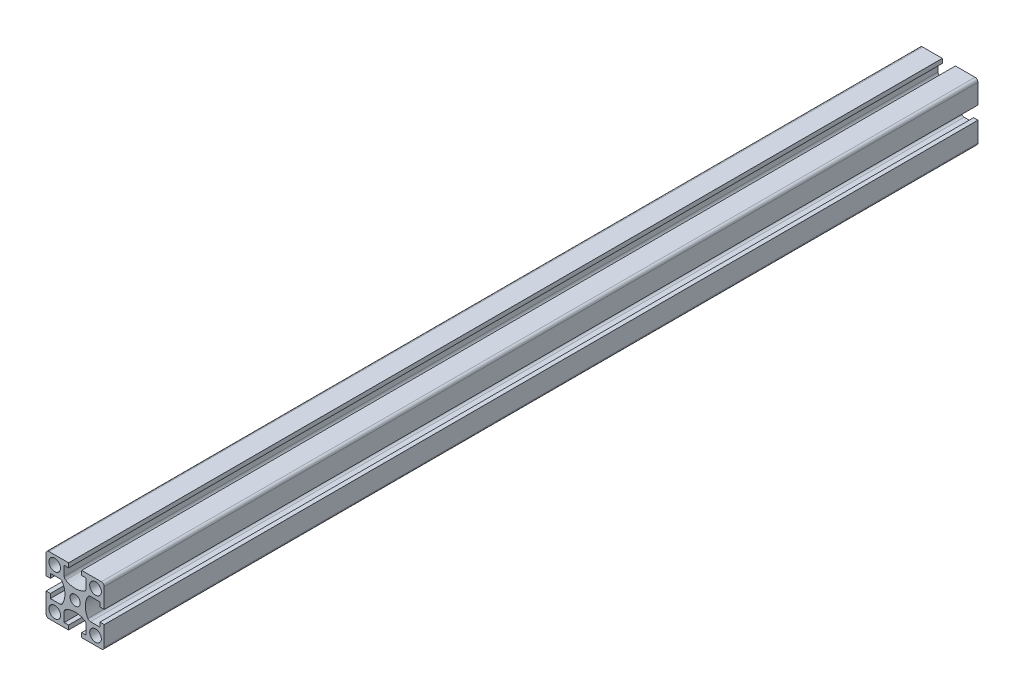
from build123d import *

# Parameters (mm, degrees)
SKETCH1_R           = 4
SKETCH1_R_2         = 3.5
BOSS_EXTRUDE1_DEPTH = 600


with BuildPart() as part:
    # Sketch1 → Boss-Extrude1 (new body)
    with BuildSketch(Plane.XY):
        with BuildLine():
            Line((-20, 18), (-20, 4.5))
            Line((-20, 4.5), (-17, 4.5))
            Line((-17, 4.5), (-17, 7.5))
            Line((-17, 7.5), (-10.473720558, 7.5))
            ThreePointArc((-10.473720558, 7.5), (-9.473720558, 7.232050808), (-8.741669751, 6.5))
            ThreePointArc((-8.741669751, 6.5), (-7, 0), (-8.741669751, -6.5))
            ThreePointArc((-8.741669751, -6.5), (-9.473720558, -7.232050808), (-10.473720558, -7.5))
            Line((-10.473720558, -7.5), (-17, -7.5))
            Line((-17, -7.5), (-17, -4.5))
            Line((-17, -4.5), (-20, -4.5))
            Line((-20, -4.5), (-20, -18))
            ThreePointArc((-20, -18), (-19.414213562, -19.414213562), (-18, -20))
            Line((-18, -20), (-4.5, -20))
            Line((-4.5, -20), (-4.5, -17))
            Line((-4.5, -17), (-7.5, -17))
            Line((-7.5, -17), (-7.5, -10.473720558))
            ThreePointArc((-7.5, -10.473720558), (-7.232050808, -9.473720558), (-6.5, -8.741669751))
            ThreePointArc((-6.5, -8.741669751), (0, -7), (6.5, -8.741669751))
            ThreePointArc((6.5, -8.741669751), (7.232050808, -9.473720558), (7.5, -10.473720558))
            Line((7.5, -10.473720558), (7.5, -17))
            Line((7.5, -17), (4.5, -17))
            Line((4.5, -17), (4.5, -20))
            Line((4.5, -20), (18, -20))
            ThreePointArc((18, -20), (19.414213562, -19.414213562), (20, -18))
            Line((20, -18), (20, -4.5))
            Line((20, -4.5), (17, -4.5))
            Line((17, -4.5), (17, -7.5))
            Line((17, -7.5), (10.473720558, -7.5))
            ThreePointArc((10.473720558, -7.5), (9.473720558, -7.232050808), (8.741669751, -6.5))
            ThreePointArc((8.741669751, -6.5), (7, 0), (8.741669751, 6.5))
            ThreePointArc((8.741669751, 6.5), (9.473720558, 7.232050808), (10.473720558, 7.5))
            Line((10.473720558, 7.5), (17, 7.5))
            Line((17, 7.5), (17, 4.5))
            Line((17, 4.5), (20, 4.5))
            Line((20, 4.5), (20, 18))
            ThreePointArc((20, 18), (19.414213562, 19.414213562), (18, 20))
            Line((18, 20), (4.5, 20))
            Line((4.5, 20), (4.5, 17))
            Line((4.5, 17), (7.5, 17))
            Line((7.5, 17), (7.5, 10.473720558))
            ThreePointArc((7.5, 10.473720558), (7.232050808, 9.473720558), (6.5, 8.741669751))
            ThreePointArc((6.5, 8.741669751), (0, 7), (-6.5, 8.741669751))
            ThreePointArc((-6.5, 8.741669751), (-7.232050808, 9.473720558), (-7.5, 10.473720558))
            Line((-7.5, 10.473720558), (-7.5, 17))
            Line((-7.5, 17), (-4.5, 17))
            Line((-4.5, 17), (-4.5, 20))
            Line((-4.5, 20), (-18, 20))
            ThreePointArc((-18, 20), (-19.414213562, 19.414213562), (-20, 18))
        make_face()
        with Locations((-14, -14)):
            Circle(SKETCH1_R, mode=Mode.SUBTRACT)
        with Locations((14, -14)):
            Circle(SKETCH1_R, mode=Mode.SUBTRACT)
        with Locations((14, 14)):
            Circle(SKETCH1_R, mode=Mode.SUBTRACT)
        Circle(SKETCH1_R_2, mode=Mode.SUBTRACT)
        with Locations((-14, 14)):
            Circle(SKETCH1_R, mode=Mode.SUBTRACT)
    extrude(amount=BOSS_EXTRUDE1_DEPTH)


solid = part.part
